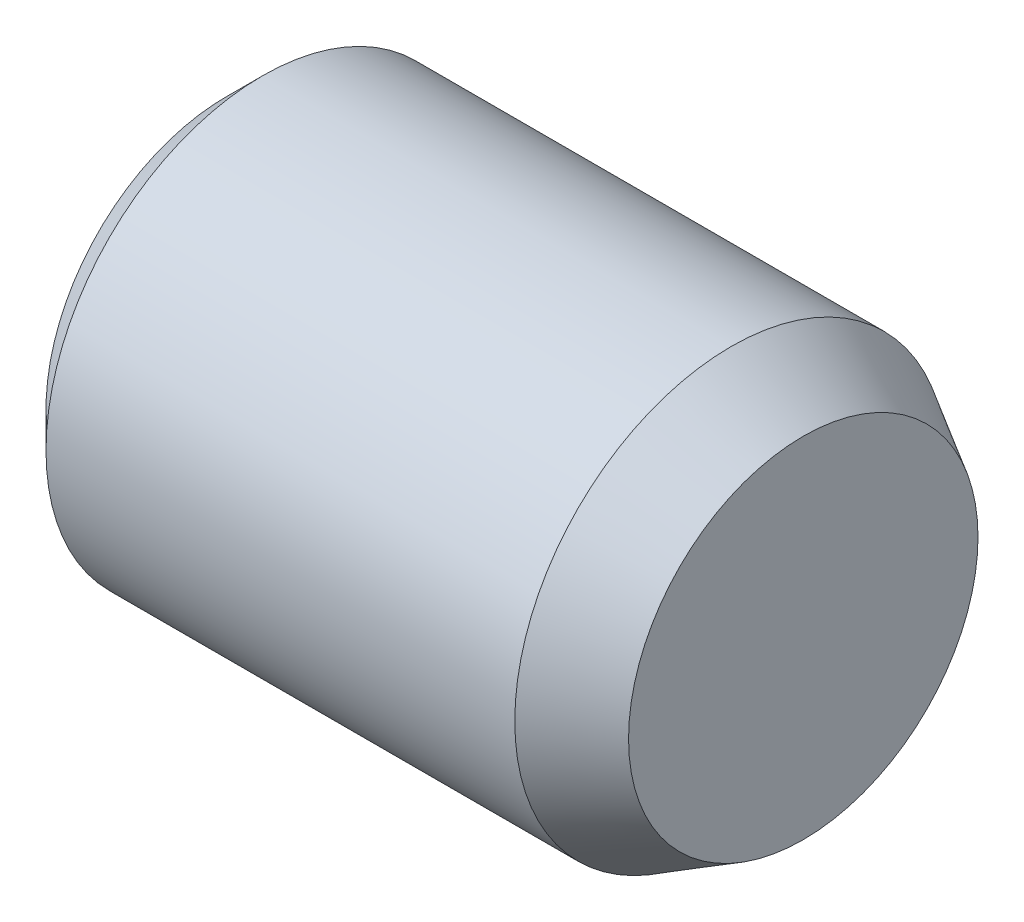
from build123d import *

# Parameters (mm, degrees)
D_RA1_D         = 3.5
D_RA1_DEPTH     = 4
D_RA1_TIP       = 1.051506083
VYSUNOUT1_REACH = 11.055


with BuildPart() as part:
    # Skica1 → Otočit kolem osy1 (revolve)
    with BuildSketch(Plane(origin=(0, 0, 0), x_dir=(1, 0, 0), z_dir=(0, 1, 0))):
        Polygon((0, 0), (0, 2.5), (0.5, 3), (7, 3), (8, 2.422649731), (8, 0), align=None)
    revolve(axis=Axis((8, 0, 0), (-1, 0, 0)))

    # Díra1
    with Locations(Plane.ZY):
        with Locations((0, 0)):
            Hole(D_RA1_D / 2, depth=D_RA1_DEPTH)
            with Locations((0, 0, -(D_RA1_DEPTH + D_RA1_TIP / 2))):  # 118° drill point
                Cone(0, D_RA1_D / 2, D_RA1_TIP, mode=Mode.SUBTRACT)

    # Vysunout1: up to this cone (the profile starts inside it)
    vysunout1_end = Plane(origin=(0, 0, 0), z_dir=(-1, 0, 0)).offset(-5.051505083) * Cone(1.664e-06, 41.629661224, 25.013623013, align=(Align.CENTER, Align.CENTER, Align.MIN), mode=Mode.PRIVATE)
    # Skica4 → Vysunout1 (add, up to the surface)
    with BuildSketch(Plane.ZY, mode=Mode.PRIVATE) as vysunout1_sk1:
        with BuildLine():
            Line((-1.75, 0), (-0.875, 1.515544457))
            ThreePointArc((-0.875, 1.515544457), (-1.515544457, 0.875), (-1.75, 0))
        make_face()
    vysunout1_tool1 = extrude(vysunout1_sk1.sketch, amount=-VYSUNOUT1_REACH, mode=Mode.PRIVATE) & vysunout1_end
    add(vysunout1_tool1.solids().sort_by_distance((0, 0.804943, -1.394203))[0])
    # Skica4 → Vysunout1 (add, up to the surface)
    with BuildSketch(Plane.ZY, mode=Mode.PRIVATE) as vysunout1_sk2:
        with BuildLine():
            ThreePointArc((0.875, 1.515544457), (0, 1.75), (-0.875, 1.515544457))
            Line((-0.875, 1.515544457), (0.875, 1.515544457))
        make_face()
    vysunout1_tool2 = extrude(vysunout1_sk2.sketch, amount=-VYSUNOUT1_REACH, mode=Mode.PRIVATE) & vysunout1_end
    add(vysunout1_tool2.solids().sort_by_distance((0, 1.609887, 0))[0])
    # Skica4 → Vysunout1 (add, up to the surface)
    with BuildSketch(Plane.ZY, mode=Mode.PRIVATE) as vysunout1_sk3:
        with BuildLine():
            ThreePointArc((1.75, 0), (1.515544457, 0.875), (0.875, 1.515544457))
            Line((0.875, 1.515544457), (1.75, 0))
        make_face()
    vysunout1_tool3 = extrude(vysunout1_sk3.sketch, amount=-VYSUNOUT1_REACH, mode=Mode.PRIVATE) & vysunout1_end
    add(vysunout1_tool3.solids().sort_by_distance((0, 0.804943, 1.394203))[0])
    # Skica4 → Vysunout1 (add, up to the surface)
    with BuildSketch(Plane.ZY, mode=Mode.PRIVATE) as vysunout1_sk4:
        with BuildLine():
            ThreePointArc((0.875, -1.515544457), (1.515544457, -0.875), (1.75, 0))
            Line((1.75, 0), (0.875, -1.515544457))
        make_face()
    vysunout1_tool4 = extrude(vysunout1_sk4.sketch, amount=-VYSUNOUT1_REACH, mode=Mode.PRIVATE) & vysunout1_end
    add(vysunout1_tool4.solids().sort_by_distance((0, -0.804943, 1.394203))[0])
    # Skica4 → Vysunout1 (add, up to the surface)
    with BuildSketch(Plane.ZY, mode=Mode.PRIVATE) as vysunout1_sk5:
        with BuildLine():
            Line((0.875, -1.515544457), (-0.875, -1.515544457))
            ThreePointArc((-0.875, -1.515544457), (0, -1.75), (0.875, -1.515544457))
        make_face()
    vysunout1_tool5 = extrude(vysunout1_sk5.sketch, amount=-VYSUNOUT1_REACH, mode=Mode.PRIVATE) & vysunout1_end
    add(vysunout1_tool5.solids().sort_by_distance((0, -1.609887, 0))[0])
    # Skica4 → Vysunout1 (add, up to the surface)
    with BuildSketch(Plane.ZY, mode=Mode.PRIVATE) as vysunout1_sk6:
        with BuildLine():
            Line((-0.875, -1.515544457), (-1.75, 0))
            ThreePointArc((-1.75, 0), (-1.515544457, -0.875), (-0.875, -1.515544457))
        make_face()
    vysunout1_tool6 = extrude(vysunout1_sk6.sketch, amount=-VYSUNOUT1_REACH, mode=Mode.PRIVATE) & vysunout1_end
    add(vysunout1_tool6.solids().sort_by_distance((0, -0.804943, -1.394203))[0])

    # Skica5 → Odebrat otočením1 (revolve, cut)
    with BuildSketch(Plane(origin=(0, 0, 0), x_dir=(1, 0, 0), z_dir=(0, 1, 0))):
        Polygon((0, 1.75), (1.010362971, 0), (0, 0), align=None)
    revolve(axis=Axis((1.010362971, 0, 0), (-1, 0, 0)), mode=Mode.SUBTRACT)


solid = part.part
